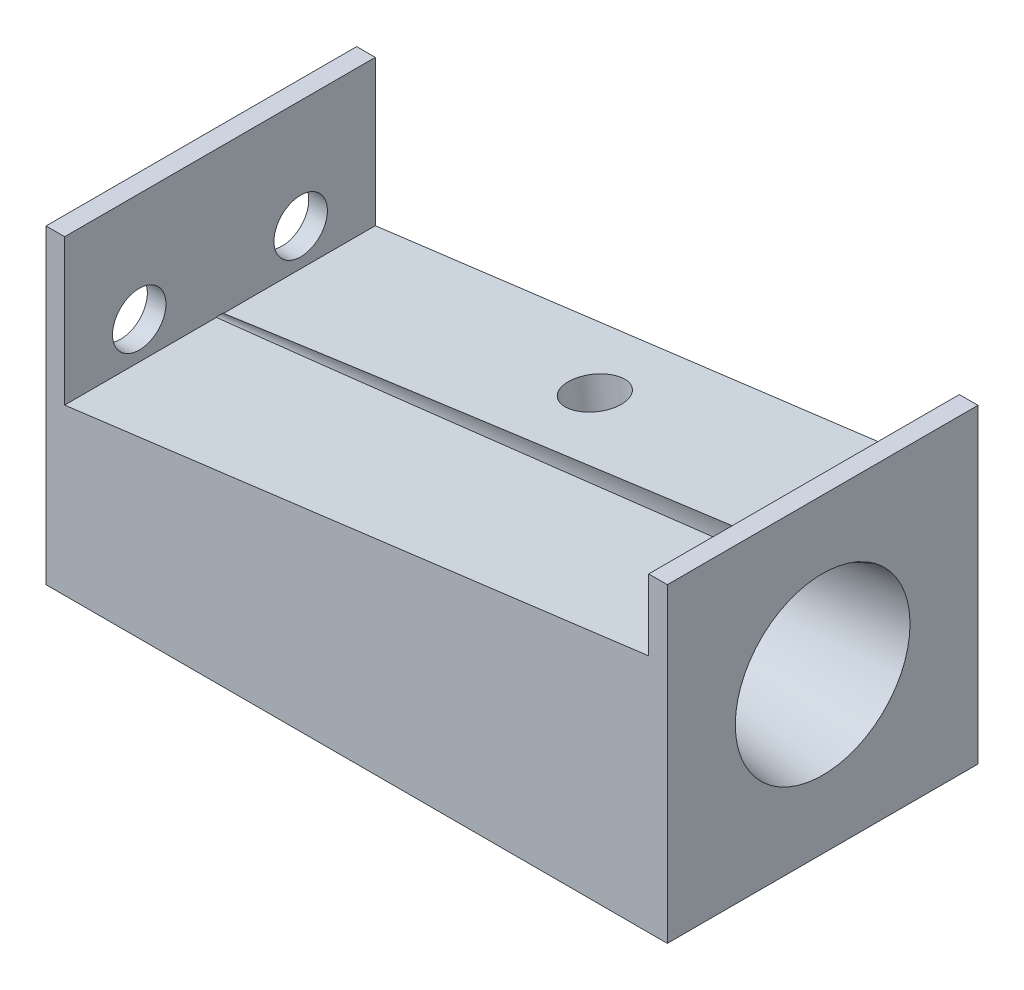
from build123d import *

# Parameters (mm, degrees)
SKETCH1_W                 = 25.4
SKETCH1_H                 = 12.7
BOSS_EXTRUDE1_DEPTH       = 12.7
SKETCH2_R                 = 3.571875
SKETCH3_R                 = 0.3175
CUT_EXTRUDE2_REACH        = 23.997
F_2_56_TAPPED_HOLE2_D     = 2.1844
F_2_56_TAPPED_HOLE2_DEPTH = 3.302
F_2_56_TAPPED_HOLE2_TIP   = 0.656259968
CIRPATTERN1_COUNT         = 3


with BuildPart() as part:
    # Sketch1 → Boss-Extrude1 (new body)
    with BuildSketch(Plane(origin=(0, 0, 0), x_dir=(1, 0, 0), z_dir=(0, 1, 0))):
        Rectangle(SKETCH1_W, SKETCH1_H)
    extrude(amount=BOSS_EXTRUDE1_DEPTH)

    # Sketch2 → Cut-Loft2 section 0
    with BuildSketch(Plane(origin=(12.7, 0, 0), x_dir=(0, 0, -1), z_dir=(1, 0, 0))):
        with Locations((0, 6.35)):
            Circle(SKETCH2_R)
    # Sketch3 → Cut-Loft2 section 1
    with BuildSketch(Plane.ZY.offset(12.7)):
        with Locations((0, 6.35)):
            Circle(SKETCH3_R)
    loft(mode=Mode.SUBTRACT)

    # Cut-Extrude2: up to this face of the body (flat: up to its plane)
    cut_extrude2_end = Plane(part.part.faces().sort_by_distance((0, 6.35, -6.35))[0])
    # Sketch6 → Cut-Extrude2 (cut, up to the picked face)
    with BuildSketch(Plane.XY.offset(6.35), mode=Mode.PRIVATE) as cut_extrude2_sk1:
        Polygon((-11.938, 12.7), (11.938, 12.7), (11.938, 9.798636115), (-11.938, 6.739523615), align=None)
    cut_extrude2_tool1 = split(extrude(cut_extrude2_sk1.sketch, amount=-CUT_EXTRUDE2_REACH, mode=Mode.PRIVATE), bisect_by=cut_extrude2_end, keep=Keep.BOTH, mode=Mode.PRIVATE)
    add(cut_extrude2_tool1.solids().sort_by(Axis((-1.373668, 10.396539, 6.35), (0, 0, -1)))[0], mode=Mode.SUBTRACT)

    # #2-56 Tapped Hole2
    with Locations(Plane(origin=(-1.042364388, 8.135526928, 0), x_dir=(0.9918916863822601, 0.12708612231772706, 0), z_dir=(-0.12708612231772703, 0.99189168638226, 0))):
        with Locations((1.050885295, 3.385522314)):
            Hole(F_2_56_TAPPED_HOLE2_D / 2, depth=F_2_56_TAPPED_HOLE2_DEPTH)
            with Locations((0, 0, -(F_2_56_TAPPED_HOLE2_DEPTH + F_2_56_TAPPED_HOLE2_TIP / 2))):  # 118° drill point
                Cone(0, F_2_56_TAPPED_HOLE2_D / 2, F_2_56_TAPPED_HOLE2_TIP, mode=Mode.SUBTRACT)

    # Sketch26 → #2-56 Tapped Hole3 (revolve, cut)
    with BuildSketch(Plane(origin=(-12.7, 2.54, 0), x_dir=(0, 0, 1), z_dir=(0, 1, 0))):
        Polygon((0, 0), (0, 3.958259968), (1.0922, 3.302), (1.0922, 0), align=None)
    f_2_56_tapped_hole3 = revolve(axis=Axis((-19.05, 2.54, 0), (1, 0, 0)), mode=Mode.SUBTRACT)

    # CirPattern1: #2-56 Tapped Hole3 ×3 about axis
    cirpattern1_axis = Axis((0, 6.35, 0), (1, 0, 0))
    for i in range(1, CIRPATTERN1_COUNT):
        add(f_2_56_tapped_hole3.rotate(cirpattern1_axis, i * 360 / CIRPATTERN1_COUNT), mode=Mode.SUBTRACT)


solid = part.part
